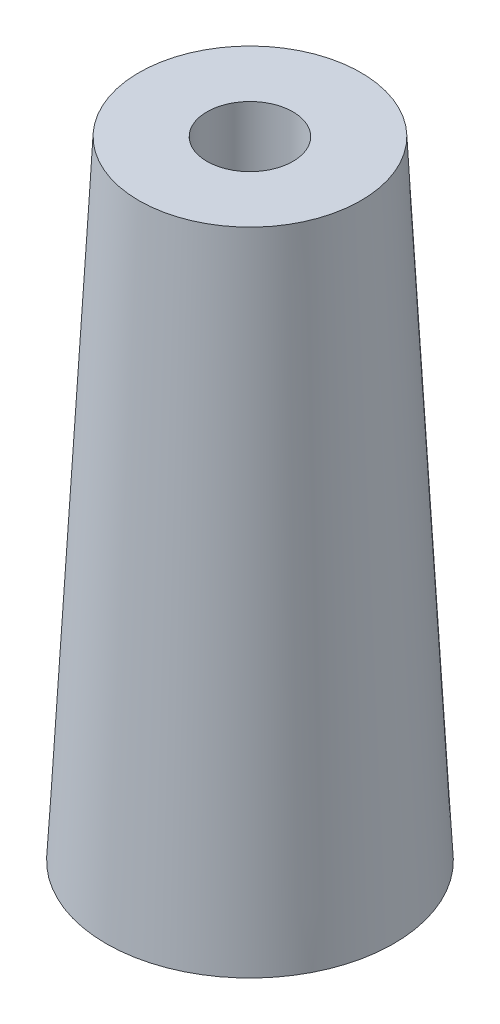
from build123d import *

# Parameters (mm, degrees)
SKETCH1_R                  = 6.35
BOSS_EXTRUDE1_DEPTH        = 27.686
BOSS_EXTRUDE1_TAPER        = 3
F_10_24_TAPPED_HOLE1_D     = 3.7973
F_10_24_TAPPED_HOLE1_DEPTH = 12.7
F_10_24_TAPPED_HOLE1_TIP   = 1.140824014


with BuildPart() as part:
    # Sketch1 → Boss-Extrude1 (new body)
    with BuildSketch(Plane(origin=(0, 0, 0), x_dir=(1, 0, 0), z_dir=(0, 1, 0))):
        Circle(SKETCH1_R)
    extrude(amount=BOSS_EXTRUDE1_DEPTH, taper=BOSS_EXTRUDE1_TAPER)

    # #10-24 Tapped Hole1
    with Locations(Plane(origin=(0, 27.686, 0), x_dir=(1, 0, 0), z_dir=(0, 1, 0))):
        with Locations((0, 0)):
            Hole(F_10_24_TAPPED_HOLE1_D / 2, depth=F_10_24_TAPPED_HOLE1_DEPTH)
            with Locations((0, 0, -(F_10_24_TAPPED_HOLE1_DEPTH + F_10_24_TAPPED_HOLE1_TIP / 2))):  # 118° drill point
                Cone(0, F_10_24_TAPPED_HOLE1_D / 2, F_10_24_TAPPED_HOLE1_TIP, mode=Mode.SUBTRACT)


solid = part.part
